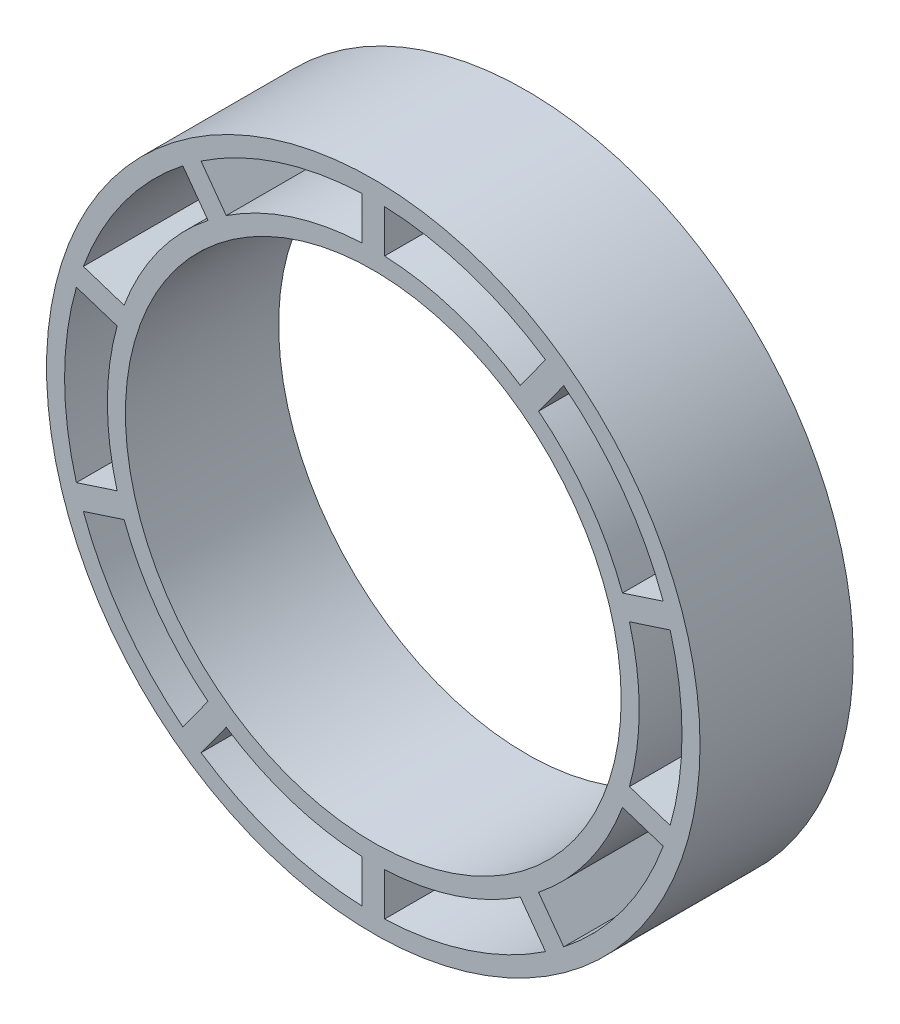
from build123d import *

# Parameters (mm, degrees)
SZKIC1_R                    = 72.5
SZKIC1_R_2                  = 2
SZKIC1_R_3                  = 55
DODANIE_WYCI_GNI_CIE1_DEPTH = 4
SZKIC1_3_R                  = 72.5
SZKIC1_3_R_2                = 68.5
SZKIC1_3_R_3                = 59
SZKIC1_3_R_4                = 55
DODANIE_WYCI_GNI_CIE2_DEPTH = 34
DODANIE_WYCI_GNI_CIE3_DEPTH = 30
SZYK_KO_OWY1_COUNT          = 10


with BuildPart() as part:
    # Szkic1 → Dodanie-wyciągnięcie1 (new body)
    with BuildSketch(Plane.XY):
        Circle(SZKIC1_R)
        with Locations((19.699833391, 60.629852914)):
            Circle(SZKIC1_R_2, mode=Mode.SUBTRACT)
        with Locations((-51.574833391, -37.471309834)):
            Circle(SZKIC1_R_2, mode=Mode.SUBTRACT)
        with Locations((19.699833391, -60.629852914)):
            Circle(SZKIC1_R_2, mode=Mode.SUBTRACT)
        with Locations((-51.574833391, 37.471309834)):
            Circle(SZKIC1_R_2, mode=Mode.SUBTRACT)
        with Locations((63.75, 0)):
            Circle(SZKIC1_R_2, mode=Mode.SUBTRACT)
        Circle(SZKIC1_R_3, mode=Mode.SUBTRACT)
    extrude(amount=DODANIE_WYCI_GNI_CIE1_DEPTH)

    # Szkic1<3> → Dodanie-wyciągnięcie2 (add)
    # profile 1 of 2: a face of its own
    with BuildSketch(Plane.XY):
        Circle(SZKIC1_3_R)
        Circle(SZKIC1_3_R_2, mode=Mode.SUBTRACT)
    # profile 2 of 2: a face of its own
    with BuildSketch(Plane.XY):
        Circle(SZKIC1_3_R_3)
        Circle(SZKIC1_3_R_4, mode=Mode.SUBTRACT)
    extrude(amount=DODANIE_WYCI_GNI_CIE2_DEPTH)

    # Szkic2 → Dodanie-wyciągnięcie3 (add)
    with BuildSketch(Plane.XY.offset(4)):
        Polygon((-2.5, 58.947010102), (-2.5, 68.45436436), (0, 72.265754907), (2.5, 68.45436436), (2.5, 58.947010102), (0, 55.135619556), align=None)
    dodanie_wyci_gni_cie3 = extrude(amount=DODANIE_WYCI_GNI_CIE3_DEPTH)

    # Szyk kołowy1: Dodanie-wyciągnięcie3 ×10 about axis
    szyk_ko_owy1_axis = Axis((0, 0, 34), (0, 0, 1))
    for i in range(1, SZYK_KO_OWY1_COUNT):
        add(dodanie_wyci_gni_cie3.rotate(szyk_ko_owy1_axis, i * 360 / SZYK_KO_OWY1_COUNT))


solid = part.part
